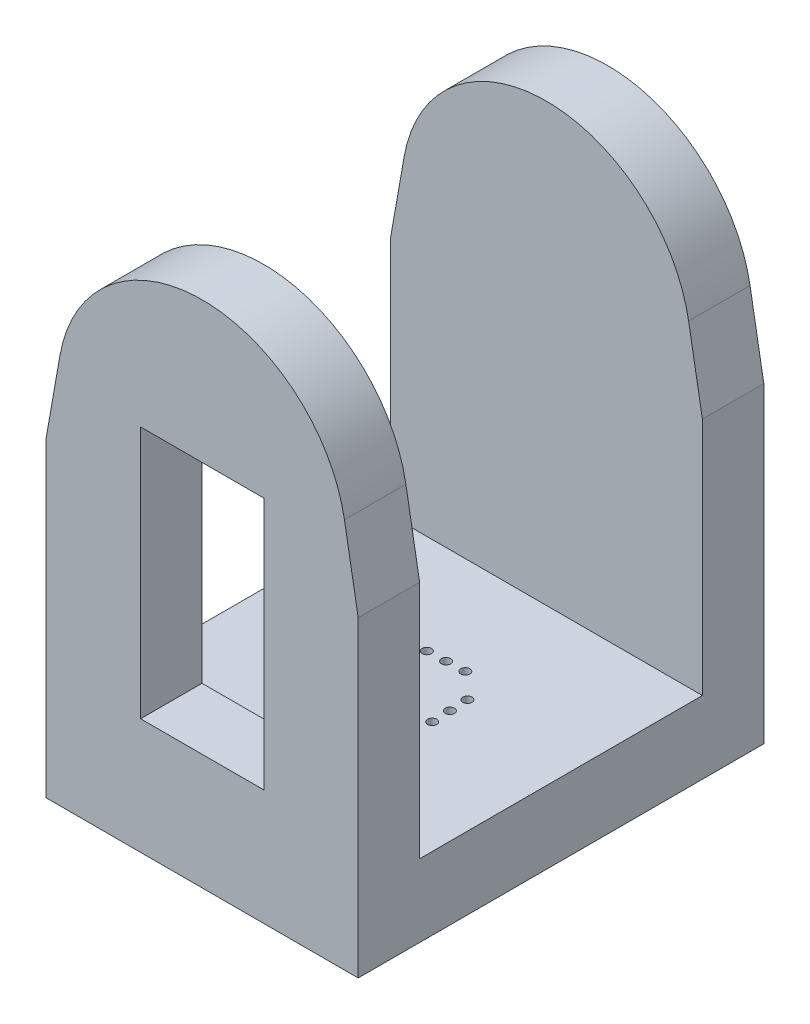
from build123d import *

# Parameters (mm, degrees)
BOSS_EXTRUDE2_DEPTH      = 33.02
BOSS_EXTRUDE2_DEPTH_BACK = 33.02
SKETCH5_W                = 50.93744157
SKETCH5_H                = 46.03648482
CUT_EXTRUDE2_DEPTH       = 71.12
SKETCH9_R                = 12.7
SKETCH9_R_2              = 9.525
BOSS_EXTRUDE3_DEPTH      = 7.62
CUT_EXTRUDE3_REACH       = 86.659
SKETCH10_R               = 0.75
CUT_EXTRUDE4_REACH       = 112.716
SKETCH11_W               = 20.066
SKETCH11_H               = 41.148


with BuildPart() as part:
    # Sketch3 → Boss-Extrude2 (new, two sides: drawn at the far end of the back side and taken through both)
    with BuildSketch(Plane.XY.offset(-BOSS_EXTRUDE2_DEPTH_BACK)):
        with BuildLine():
            Line((-31.917133282, 0), (18.882866718, 0))
            Line((18.882866718, 0), (18.882866718, 50.8))
            Line((18.882866718, 50.8), (16.643514063, 63.5))
            ThreePointArc((16.643514063, 63.5), (-6.517133282, 82.934090645), (-29.677780627, 63.5))
            Line((-29.677780627, 63.5), (-31.917133282, 50.8))
            Line((-31.917133282, 50.8), (-31.917133282, 0))
        make_face()
    extrude(amount=BOSS_EXTRUDE2_DEPTH + BOSS_EXTRUDE2_DEPTH_BACK)

    # Sketch5 → Cut-Extrude2 (cut)
    with BuildSketch(Plane(origin=(0, 82.934090645, 0), x_dir=(1, 0, 0), z_dir=(0, 1, 0))):
        with Locations((-6.517133282, 0)):
            Rectangle(SKETCH5_W, SKETCH5_H)
    extrude(amount=-CUT_EXTRUDE2_DEPTH, mode=Mode.SUBTRACT)

    # Sketch9 → Boss-Extrude3 (add)
    with BuildSketch(Plane.XZ):
        with Locations((-6.517133282, 0)):
            Circle(SKETCH9_R)
        with Locations((-6.517133282, 0)):
            Circle(SKETCH9_R_2, mode=Mode.SUBTRACT)
    extrude(amount=BOSS_EXTRUDE3_DEPTH)

    # Sketch10 → Cut-Extrude3 (cut, up to next)
    with BuildSketch(Plane(origin=(0, 11.814090645, 0), x_dir=(1, 0, 0), z_dir=(0, 1, 0)), mode=Mode.PRIVATE) as cut_extrude3_sk1:
        with Locations((-3.214362801, -6.862339772)):
            Circle(SKETCH10_R)
    cut_extrude3_tool1 = extrude(cut_extrude3_sk1.sketch, amount=-CUT_EXTRUDE3_REACH, mode=Mode.PRIVATE) & part.part
    # Sketch10 → Cut-Extrude3 (cut, up to next)
    with BuildSketch(Plane(origin=(0, 11.814090645, 0), x_dir=(1, 0, 0), z_dir=(0, 1, 0)), mode=Mode.PRIVATE) as cut_extrude3_sk2:
        with Locations((-6.211501931, -6.993324637)):
            Circle(SKETCH10_R)
    cut_extrude3_tool2 = extrude(cut_extrude3_sk2.sketch, amount=-CUT_EXTRUDE3_REACH, mode=Mode.PRIVATE) & part.part
    # Sketch10 → Cut-Extrude3 (cut, up to next)
    with BuildSketch(Plane(origin=(0, 11.814090645, 0), x_dir=(1, 0, 0), z_dir=(0, 1, 0)), mode=Mode.PRIVATE) as cut_extrude3_sk3:
        with Locations((-9.208641061, -7.124309502)):
            Circle(SKETCH10_R)
    cut_extrude3_tool3 = extrude(cut_extrude3_sk3.sketch, amount=-CUT_EXTRUDE3_REACH, mode=Mode.PRIVATE) & part.part
    # Sketch10 → Cut-Extrude3 (cut, up to next)
    with BuildSketch(Plane(origin=(0, 11.814090645, 0), x_dir=(1, 0, 0), z_dir=(0, 1, 0)), mode=Mode.PRIVATE) as cut_extrude3_sk4:
        with Locations((-13.379473054, -3.302770481)):
            Circle(SKETCH10_R)
    cut_extrude3_tool4 = extrude(cut_extrude3_sk4.sketch, amount=-CUT_EXTRUDE3_REACH, mode=Mode.PRIVATE) & part.part
    # Sketch10 → Cut-Extrude3 (cut, up to next)
    with BuildSketch(Plane(origin=(0, 11.814090645, 0), x_dir=(1, 0, 0), z_dir=(0, 1, 0)), mode=Mode.PRIVATE) as cut_extrude3_sk5:
        with Locations((-13.510457919, -0.305631351)):
            Circle(SKETCH10_R)
    cut_extrude3_tool5 = extrude(cut_extrude3_sk5.sketch, amount=-CUT_EXTRUDE3_REACH, mode=Mode.PRIVATE) & part.part
    # Sketch10 → Cut-Extrude3 (cut, up to next)
    with BuildSketch(Plane(origin=(0, 11.814090645, 0), x_dir=(1, 0, 0), z_dir=(0, 1, 0)), mode=Mode.PRIVATE) as cut_extrude3_sk6:
        with Locations((-13.641442784, 2.691507779)):
            Circle(SKETCH10_R)
    cut_extrude3_tool6 = extrude(cut_extrude3_sk6.sketch, amount=-CUT_EXTRUDE3_REACH, mode=Mode.PRIVATE) & part.part
    # Sketch10 → Cut-Extrude3 (cut, up to next)
    with BuildSketch(Plane(origin=(0, 11.814090645, 0), x_dir=(1, 0, 0), z_dir=(0, 1, 0)), mode=Mode.PRIVATE) as cut_extrude3_sk7:
        with Locations((0.60717622, -2.691507779)):
            Circle(SKETCH10_R)
    cut_extrude3_tool7 = extrude(cut_extrude3_sk7.sketch, amount=-CUT_EXTRUDE3_REACH, mode=Mode.PRIVATE) & part.part
    # Sketch10 → Cut-Extrude3 (cut, up to next)
    with BuildSketch(Plane(origin=(0, 11.814090645, 0), x_dir=(1, 0, 0), z_dir=(0, 1, 0)), mode=Mode.PRIVATE) as cut_extrude3_sk8:
        with Locations((0.476191355, 0.305631351)):
            Circle(SKETCH10_R)
    cut_extrude3_tool8 = extrude(cut_extrude3_sk8.sketch, amount=-CUT_EXTRUDE3_REACH, mode=Mode.PRIVATE) & part.part
    # Sketch10 → Cut-Extrude3 (cut, up to next)
    with BuildSketch(Plane(origin=(0, 11.814090645, 0), x_dir=(1, 0, 0), z_dir=(0, 1, 0)), mode=Mode.PRIVATE) as cut_extrude3_sk9:
        with Locations((0.34520649, 3.302770481)):
            Circle(SKETCH10_R)
    cut_extrude3_tool9 = extrude(cut_extrude3_sk9.sketch, amount=-CUT_EXTRUDE3_REACH, mode=Mode.PRIVATE) & part.part
    # Sketch10 → Cut-Extrude3 (cut, up to next)
    with BuildSketch(Plane(origin=(0, 11.814090645, 0), x_dir=(1, 0, 0), z_dir=(0, 1, 0)), mode=Mode.PRIVATE) as cut_extrude3_sk10:
        with Locations((-3.825625503, 7.124309502)):
            Circle(SKETCH10_R)
    cut_extrude3_tool10 = extrude(cut_extrude3_sk10.sketch, amount=-CUT_EXTRUDE3_REACH, mode=Mode.PRIVATE) & part.part
    # Sketch10 → Cut-Extrude3 (cut, up to next)
    with BuildSketch(Plane(origin=(0, 11.814090645, 0), x_dir=(1, 0, 0), z_dir=(0, 1, 0)), mode=Mode.PRIVATE) as cut_extrude3_sk11:
        with Locations((-6.822764633, 6.993324637)):
            Circle(SKETCH10_R)
    cut_extrude3_tool11 = extrude(cut_extrude3_sk11.sketch, amount=-CUT_EXTRUDE3_REACH, mode=Mode.PRIVATE) & part.part
    # Sketch10 → Cut-Extrude3 (cut, up to next)
    with BuildSketch(Plane(origin=(0, 11.814090645, 0), x_dir=(1, 0, 0), z_dir=(0, 1, 0)), mode=Mode.PRIVATE) as cut_extrude3_sk12:
        with Locations((-9.819903763, 6.862339772)):
            Circle(SKETCH10_R)
    cut_extrude3_tool12 = extrude(cut_extrude3_sk12.sketch, amount=-CUT_EXTRUDE3_REACH, mode=Mode.PRIVATE) & part.part
    add(cut_extrude3_tool1.solids().sort_by_distance((-3.214363, 11.814091, 6.86234))[0], mode=Mode.SUBTRACT)
    add(cut_extrude3_tool2.solids().sort_by_distance((-6.211502, 11.814091, 6.993325))[0], mode=Mode.SUBTRACT)
    add(cut_extrude3_tool3.solids().sort_by_distance((-9.208641, 11.814091, 7.12431))[0], mode=Mode.SUBTRACT)
    add(cut_extrude3_tool4.solids().sort_by_distance((-13.379473, 11.814091, 3.30277))[0], mode=Mode.SUBTRACT)
    add(cut_extrude3_tool5.solids().sort_by_distance((-13.510458, 11.814091, 0.305631))[0], mode=Mode.SUBTRACT)
    add(cut_extrude3_tool6.solids().sort_by_distance((-13.641443, 11.814091, -2.691508))[0], mode=Mode.SUBTRACT)
    add(cut_extrude3_tool7.solids().sort_by_distance((0.607176, 11.814091, 2.691508))[0], mode=Mode.SUBTRACT)
    add(cut_extrude3_tool8.solids().sort_by_distance((0.476191, 11.814091, -0.305631))[0], mode=Mode.SUBTRACT)
    add(cut_extrude3_tool9.solids().sort_by_distance((0.345206, 11.814091, -3.30277))[0], mode=Mode.SUBTRACT)
    add(cut_extrude3_tool10.solids().sort_by_distance((-3.825626, 11.814091, -7.12431))[0], mode=Mode.SUBTRACT)
    add(cut_extrude3_tool11.solids().sort_by_distance((-6.822765, 11.814091, -6.993325))[0], mode=Mode.SUBTRACT)
    add(cut_extrude3_tool12.solids().sort_by_distance((-9.819904, 11.814091, -6.86234))[0], mode=Mode.SUBTRACT)

    # Sketch11 → Cut-Extrude4 (cut, up to next)
    with BuildSketch(Plane.XY.offset(33.02), mode=Mode.PRIVATE) as cut_extrude4_sk1:
        with Locations((-6.517133282, 39.412411)):
            Rectangle(SKETCH11_W, SKETCH11_H)
    cut_extrude4_tool1 = extrude(cut_extrude4_sk1.sketch, amount=-CUT_EXTRUDE4_REACH, mode=Mode.PRIVATE) & part.part
    add(cut_extrude4_tool1.solids().sort_by_distance((-6.517133, 39.412411, 33.02))[0], mode=Mode.SUBTRACT)


solid = part.part
